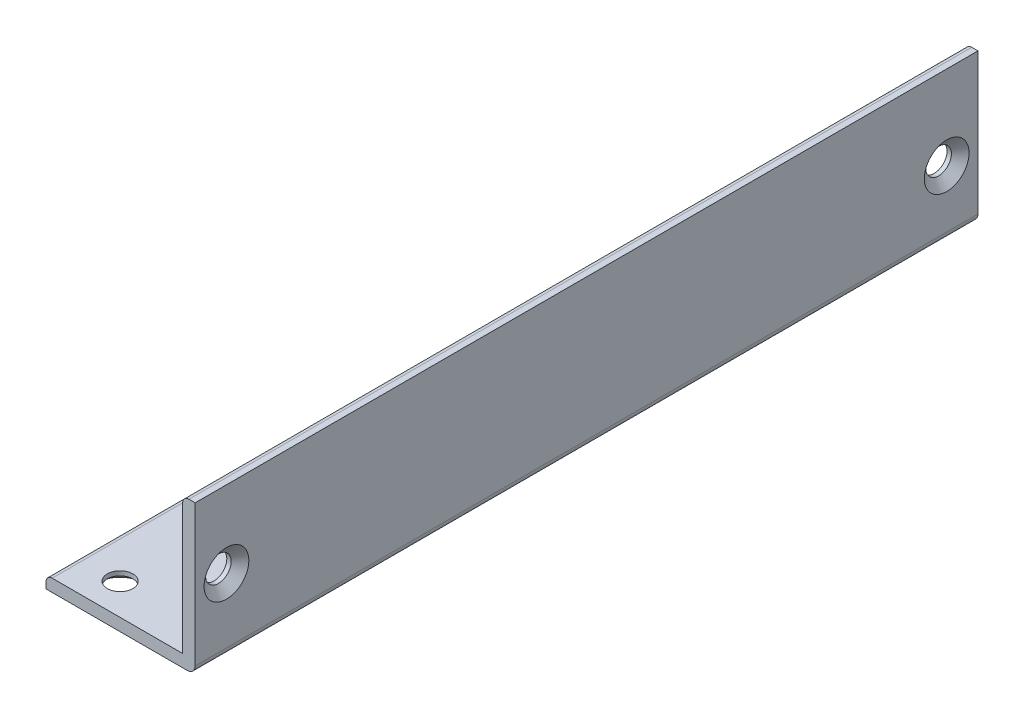
from build123d import *

# Parameters (mm, degrees)
BOSS_EXTRUDE1_DEPTH                               = 50
CSK_FOR_4_FLAT_HEAD_MACHINE_SCREW_100_D           = 3.2639
CSK_FOR_4_FLAT_HEAD_MACHINE_SCREW_100_CSINK_D     = 5.715
CSK_FOR_4_FLAT_HEAD_MACHINE_SCREW_100_CSINK_ANGLE = 100
CSK_FOR_4_FLAT_HEAD_MACHINE_SCREW_2_D             = 3.2639
CSK_FOR_4_FLAT_HEAD_MACHINE_SCREW_2_CSINK_D       = 5.715
CSK_FOR_4_FLAT_HEAD_MACHINE_SCREW_2_CSINK_ANGLE   = 100
FILLET1_R                                         = 1
F_2_CLEARANCE_HOLE1_AT_2_COUNT                    = 2
F_2_CLEARANCE_HOLE1_AT_2_PITCH                    = 4.8
CUT_EXTRUDE1_DEPTH                                = 25


with BuildPart() as part:
    # Sketch2 → Boss-Extrude1 (new, symmetric)
    with BuildSketch(Plane.XY):
        with BuildLine():
            Line((-9.525, 0), (9.525, 0))
            Line((9.525, 0), (9.525, 19.05))
            Line((9.525, 19.05), (8.73125, 19.05))
            ThreePointArc((8.73125, 19.05), (8.169983992, 18.817516008), (7.9375, 18.25625))
            Line((7.9375, 18.25625), (7.9375, 2.38125))
            ThreePointArc((7.9375, 2.38125), (7.705016008, 1.819983992), (7.14375, 1.5875))
            Line((7.14375, 1.5875), (-8.73125, 1.5875))
            ThreePointArc((-8.73125, 1.5875), (-9.292516008, 1.355016008), (-9.525, 0.79375))
            Line((-9.525, 0.79375), (-9.525, 0))
        make_face()
    extrude(amount=BOSS_EXTRUDE1_DEPTH, both=True)

    # CSK for _4 Flat Head Machine Screw _100 (through all)
    with Locations(Plane(origin=(0, 0, 0), x_dir=(-1, 0, 0), z_dir=(0, -1, 0))):
        with Locations((4.0625, -46), (4.0625, 46)):
            CounterSinkHole(CSK_FOR_4_FLAT_HEAD_MACHINE_SCREW_100_D / 2, CSK_FOR_4_FLAT_HEAD_MACHINE_SCREW_100_CSINK_D / 2, counter_sink_angle=CSK_FOR_4_FLAT_HEAD_MACHINE_SCREW_100_CSINK_ANGLE)

    # CSK for _4 Flat Head Machine Screw _ 2 (through all)
    with Locations(Plane(origin=(9.525, 0, 0), x_dir=(0, 0, -1), z_dir=(1, 0, 0))):
        with Locations((-46, 9.25), (46, 8.34)):
            CounterSinkHole(CSK_FOR_4_FLAT_HEAD_MACHINE_SCREW_2_D / 2, CSK_FOR_4_FLAT_HEAD_MACHINE_SCREW_2_CSINK_D / 2, counter_sink_angle=CSK_FOR_4_FLAT_HEAD_MACHINE_SCREW_2_CSINK_ANGLE)

    # Fillet1
    fillet1_edges = [part.edges().sort_by_distance(p)[0] for p in [
        (9.525, 0, 0),
    ]]
    fillet(fillet1_edges, radius=FILLET1_R)

    # Sketch30 → #2 Clearance Hole1 (revolve, cut)
    with BuildSketch(Plane(origin=(3.49375, 1.5875, 29.88), x_dir=(0, 0, 1), z_dir=(1, 0, 0))):
        Polygon((0, 0), (0, 1.5875), (2.0574, 1.5875), (1.2192, 0.623261201), (1.2192, 0), align=None)
    f_2_clearance_hole1 = revolve(axis=Axis((3.49375, 7.9375, 29.88), (0, -1, 0)), mode=Mode.SUBTRACT)

    # #2 Clearance Hole1 at 2: #2 Clearance Hole1 ×2
    with Locations(*[(-i * F_2_CLEARANCE_HOLE1_AT_2_PITCH, 0, 0) for i in range(1, F_2_CLEARANCE_HOLE1_AT_2_COUNT)]):
        add(f_2_clearance_hole1, mode=Mode.SUBTRACT)

    # Sketch43 → Cut-Extrude1 (cut)
    with BuildSketch(Plane(origin=(0, 0, -50), x_dir=(-1, 0, 0), z_dir=(0, 0, -1))):
        Polygon((-7.9375, 6.5875), (-7.9375, 1.5875), (-2.9375, 1.5875), align=None)
    cut_extrude1 = extrude(amount=-CUT_EXTRUDE1_DEPTH, mode=Mode.SUBTRACT)

    # Mirror1: Cut-Extrude1 across plane
    add(cut_extrude1.mirror(Plane(origin=(0, 0, 0), x_dir=(1, 0, 0), z_dir=(0, 0, -1))), mode=Mode.SUBTRACT)


solid = part.part
